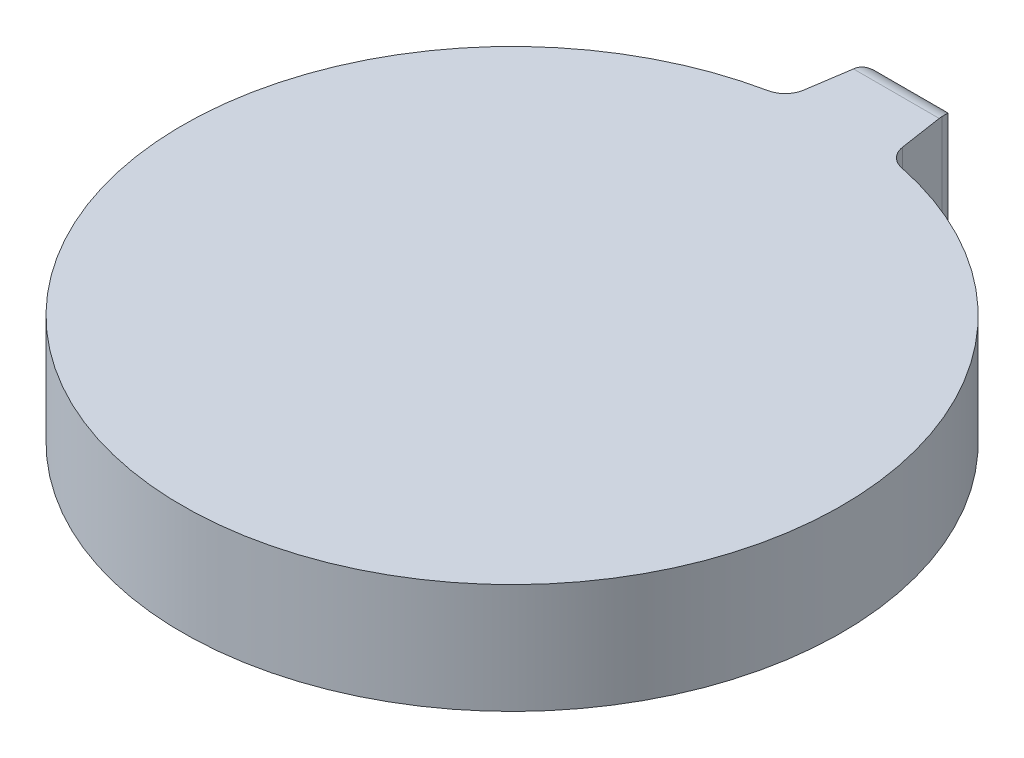
from build123d import *

# Parameters (mm, degrees)
SKETCH1_R           = 19.05
BOSS_EXTRUDE1_DEPTH = 6.35
BOSS_EXTRUDE2_DEPTH = 6.35
FILLET13_R          = 1.27
FILLET15_R          = 1.27


with BuildPart() as part:
    # Sketch1 → Boss-Extrude1 (new body)
    with BuildSketch(Plane(origin=(0, 0, 0), x_dir=(1, 0, 0), z_dir=(0, 1, 0))):
        with Locations(Location((0, 0, 0), (0, 0, 270))):
            Circle(SKETCH1_R)
    extrude(amount=BOSS_EXTRUDE1_DEPTH)

    # Sketch2 → Boss-Extrude2 (add)
    with BuildSketch(Plane(origin=(0, 0, 0), x_dir=(1, 0, 0), z_dir=(0, 1, 0))):
        Polygon((-2.992120362, 18.813551386), (-2.286000743, 23.480131449), (2.285999257, 23.480131449), (2.992119638, 18.813551501), align=None)
    extrude(amount=BOSS_EXTRUDE2_DEPTH)

    # Fillet13
    fillet13_edges = [part.edges().sort_by_distance(p)[0] for p in [
        (2.285999257, 3.175, -23.480131449),
        (-2.286000743, 3.175, -23.480131449),
        (-7.43e-07, 0, -23.480131449),
        (-7.43e-07, 6.35, -23.480131449),
    ]]
    fillet(fillet13_edges, radius=FILLET13_R)

    # Fillet15
    fillet15_edges = [part.edges().sort_by_distance(p)[0] for p in [
        (-2.992120362, 3.175, -18.813551386),
        (2.992119638, 3.175, -18.813551501),
    ]]
    fillet(fillet15_edges, radius=FILLET15_R)


solid = part.part
